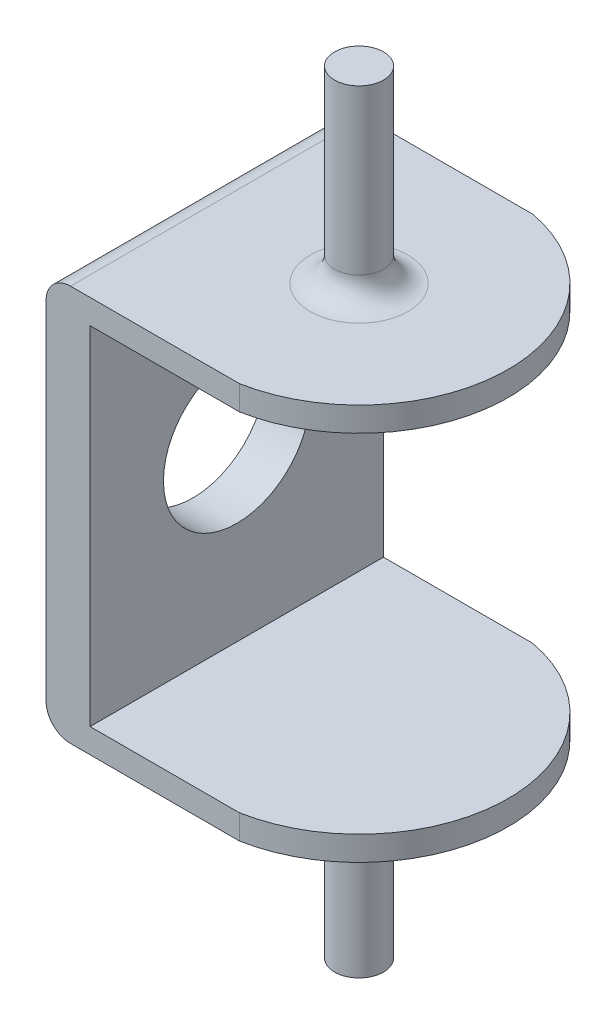
from build123d import *

# Parameters (mm, degrees)
SWEEP1_PROFILE_R    = 10
CUT_EXTRUDE1_START  = -5.9
SKETCH13_R          = 10
CUT_EXTRUDE1_DEPTH  = 5.9
SKETCH14_R          = 10
BOSS_EXTRUDE1_DEPTH = 4
BOSS_EXTRUDE2_DEPTH = 10
BOSS_EXTRUDE3_DEPTH = 120
SKETCH18_W          = 120
SKETCH18_H          = 142
CUT_EXTRUDE2_DEPTH  = 203.932082269
SKETCH19_R          = 30
CUT_EXTRUDE3_DEPTH  = 18
FILLET1_R           = 10


with BuildPart() as part:
    # Sweep1: sweep along a path in Sketch2
    with BuildLine(Plane(origin=(0, 0, 0), x_dir=(0, 0, -1), z_dir=(1, 0, 0))) as sweep1_path:
        Line((0, 158.93373393), (0, -158.93373393))
    # Sweep1 profile (on start of the path) → Sweep1 (sweep)
    with BuildSketch(Plane(origin=(0, 158.93373393, 0), x_dir=(0, 0, -1), z_dir=(0, -1, 0))):
        Circle(SWEEP1_PROFILE_R)
    sweep(path=sweep1_path.line)

    # Sketch13 → Cut-Extrude1 (cut)
    with BuildSketch(Plane(origin=(0, 158.93373393, 0), x_dir=(1, 0, 0), z_dir=(0, 1, 0)).offset(CUT_EXTRUDE1_START)):
        with Locations(Location((0, 0, 0), (0, 0, 90))):
            Circle(SKETCH13_R)
    extrude(amount=CUT_EXTRUDE1_DEPTH, mode=Mode.SUBTRACT)

    # Sketch14 → Boss-Extrude1 (add)
    with BuildSketch(Plane(origin=(0, 153.03373393, 0), x_dir=(1, 0, 0), z_dir=(0, 1, 0))):
        with Locations(Location((0, 0, 0), (0, 0, 90))):
            Circle(SKETCH14_R)
    extrude(amount=BOSS_EXTRUDE1_DEPTH)

    # Sketch16 → Boss-Extrude2 (add)
    with BuildSketch(Plane(origin=(0, 80.05, 0), x_dir=(-1, 0, 0), z_dir=(0, -1, 0))):
        with BuildLine():
            Line((11.012438692, 60), (60, 60))
            Line((60, 60), (60, -60))
            Line((60, -60), (11.012438692, -60))
            Line((11.012438692, -60), (-11.012438692, -60))
            ThreePointArc((-11.012438692, -60), (-61.00224427, 0), (-11.012438692, 60))
            Line((-11.012438692, 60), (11.012438692, 60))
        make_face()
    boss_extrude2 = extrude(amount=BOSS_EXTRUDE2_DEPTH)

    # Mirror1: Boss-Extrude2 across plane
    add(boss_extrude2.mirror(Plane(origin=(0, -0.95, 0), x_dir=(0, 0, 1), z_dir=(0, -1, 0))))

    # Sketch17 → Boss-Extrude3 (add)
    with BuildSketch(Plane(origin=(0, 0, -60), x_dir=(-1, 0, 0), z_dir=(0, 0, -1))):
        Polygon((60, -71.95), (50, -71.95), (50, 70.05), (60, 70.05), (60, 80.05), (68, 80.05), (68, -81.95), (60, -81.95), align=None)
    extrude(amount=-BOSS_EXTRUDE3_DEPTH)

    # Sketch18 → Cut-Extrude2 (cut, through all)
    with BuildSketch(Plane(origin=(-50, 0, 0), x_dir=(0, 0, -1), z_dir=(1, 0, 0))):
        with Locations((0, -0.95)):
            Rectangle(SKETCH18_W, SKETCH18_H)
    extrude(amount=CUT_EXTRUDE2_DEPTH, mode=Mode.SUBTRACT)

    # Sketch19 → Cut-Extrude3 (cut)
    with BuildSketch(Plane.ZY.offset(68)):
        Circle(SKETCH19_R)
    extrude(amount=-CUT_EXTRUDE3_DEPTH, mode=Mode.SUBTRACT)

    # Fillet1
    fillet1_edges = [part.edges().sort_by_distance(p)[0] for p in [
        (0, 80.05, 10),
        (0, -81.95, 10),
        (-68, 80.05, 0),
        (-68, -81.95, 0),
    ]]
    fillet(fillet1_edges, radius=FILLET1_R)


solid = part.part
